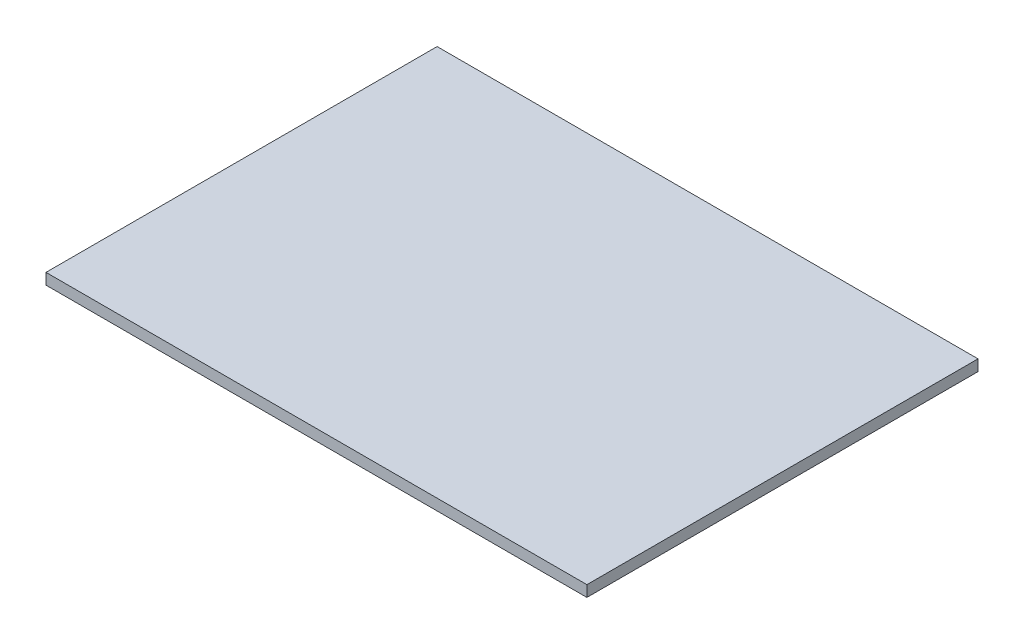
from build123d import *

# Parameters (mm, degrees)
SKETCH_1_W      = 975
SKETCH_1_H      = 705
EXTRUDE_1_DEPTH = 20


with BuildPart() as part:
    # 草图1 → 凸台-拉伸1 (new body)
    with BuildSketch(Plane(origin=(0, 0, 0), x_dir=(1, 0, 0), z_dir=(0, 1, 0))):
        with Locations((487.5, 352.5)):
            Rectangle(SKETCH_1_W, SKETCH_1_H)
    extrude(amount=EXTRUDE_1_DEPTH)


solid = part.part
